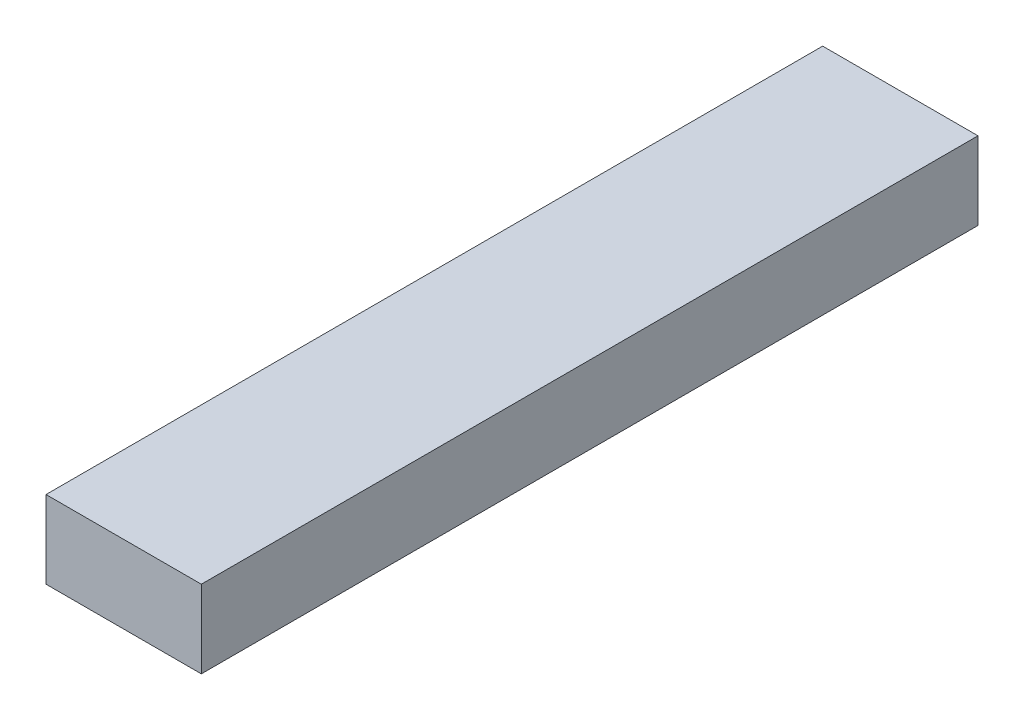
from build123d import *

# Parameters (mm, degrees)
SCHIZZO1_W                   = 200
SCHIZZO1_H                   = 100
ESTRUSIONE_ESTRUSIONE1_DEPTH = 1000


with BuildPart() as part:
    # Schizzo1 → Estrusione-Estrusione1 (new body)
    with BuildSketch(Plane.XY):
        Rectangle(SCHIZZO1_W, SCHIZZO1_H)
    extrude(amount=ESTRUSIONE_ESTRUSIONE1_DEPTH)


solid = part.part
